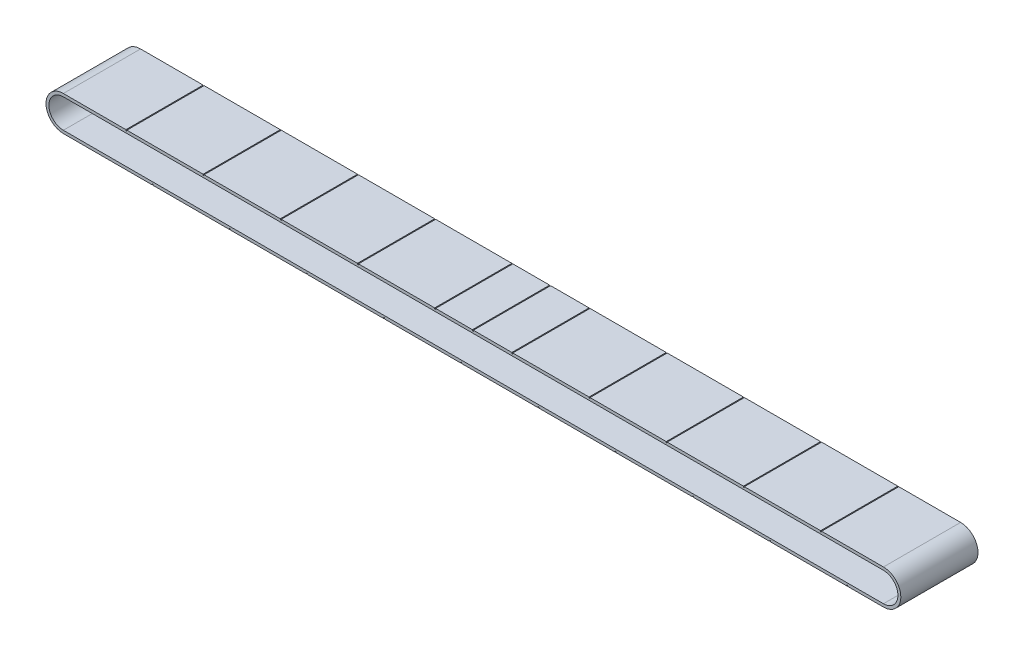
from build123d import *

# Parameters (mm, degrees)
EXTRUIR_L_MINA1_DEPTH        = 80
CROQUIS4_W                   = 1
CROQUIS4_H                   = 80
CORTAR_EXTRUIR_L_MINA1_DEPTH = 1
CROQUIS5_W                   = 1
CROQUIS5_H                   = 80
CORTAR_EXTRUIR_L_MINA2_DEPTH = 1


with BuildPart() as part:
    # Croquis1 → Extruir-Lámina1 (new body)
    with BuildSketch(Plane.XY):
        with BuildLine():
            Line((0, 3), (850, 3))
            ThreePointArc((850, 3), (868, -15), (850, -33))
            Line((850, -33), (0, -33))
            ThreePointArc((0, -33), (-18, -15), (0, 3))
        make_face()
        with BuildLine():
            Line((0, 0), (850, 0))
            ThreePointArc((850, 0), (865, -15), (850, -30))
            Line((850, -30), (0, -30))
            ThreePointArc((0, -30), (-15, -15), (0, 0))
        make_face(mode=Mode.SUBTRACT)
    extrude(amount=EXTRUIR_L_MINA1_DEPTH)

    # Croquis4 → Cortar-Extruir-Lámina1 (cut)
    with BuildSketch(Plane(origin=(0, 3, 0), x_dir=(1, 0, 0), z_dir=(0, 1, 0))):
        with Locations((424.5, -40)):
            Rectangle(CROQUIS4_W, CROQUIS4_H)
        with Locations((65.374468325, -40)):
            Rectangle(CROQUIS4_W, CROQUIS4_H)
        with Locations((145.374468325, -40)):
            Rectangle(CROQUIS4_W, CROQUIS4_H)
        with Locations((225.374468325, -40)):
            Rectangle(CROQUIS4_W, CROQUIS4_H)
        with Locations((305.374468325, -40)):
            Rectangle(CROQUIS4_W, CROQUIS4_H)
        with Locations((385.374468325, -40)):
            Rectangle(CROQUIS4_W, CROQUIS4_H)
        with Locations((465.374468325, -40)):
            Rectangle(CROQUIS4_W, CROQUIS4_H)
        with Locations((545.374468325, -40)):
            Rectangle(CROQUIS4_W, CROQUIS4_H)
        with Locations((625.374468325, -40)):
            Rectangle(CROQUIS4_W, CROQUIS4_H)
        with Locations((705.374468325, -40)):
            Rectangle(CROQUIS4_W, CROQUIS4_H)
        with Locations((785.374468325, -40)):
            Rectangle(CROQUIS4_W, CROQUIS4_H)
    extrude(amount=-CORTAR_EXTRUIR_L_MINA1_DEPTH, mode=Mode.SUBTRACT)

    # Croquis5 → Cortar-Extruir-Lámina2 (cut)
    with BuildSketch(Plane.XZ.offset(33)):
        with Locations((92.409174229, 40)):
            Rectangle(CROQUIS5_W, CROQUIS5_H)
        with Locations((172.409174229, 40)):
            Rectangle(CROQUIS5_W, CROQUIS5_H)
        with Locations((252.409174229, 40)):
            Rectangle(CROQUIS5_W, CROQUIS5_H)
        with Locations((332.409174229, 40)):
            Rectangle(CROQUIS5_W, CROQUIS5_H)
        with Locations((412.409174229, 40)):
            Rectangle(CROQUIS5_W, CROQUIS5_H)
        with Locations((492.409174229, 40)):
            Rectangle(CROQUIS5_W, CROQUIS5_H)
        with Locations((572.409174229, 40)):
            Rectangle(CROQUIS5_W, CROQUIS5_H)
        with Locations((652.409174229, 40)):
            Rectangle(CROQUIS5_W, CROQUIS5_H)
        with Locations((732.409174229, 40)):
            Rectangle(CROQUIS5_W, CROQUIS5_H)
        with Locations((812.409174229, 40)):
            Rectangle(CROQUIS5_W, CROQUIS5_H)
    extrude(amount=-CORTAR_EXTRUIR_L_MINA2_DEPTH, mode=Mode.SUBTRACT)


solid = part.part
